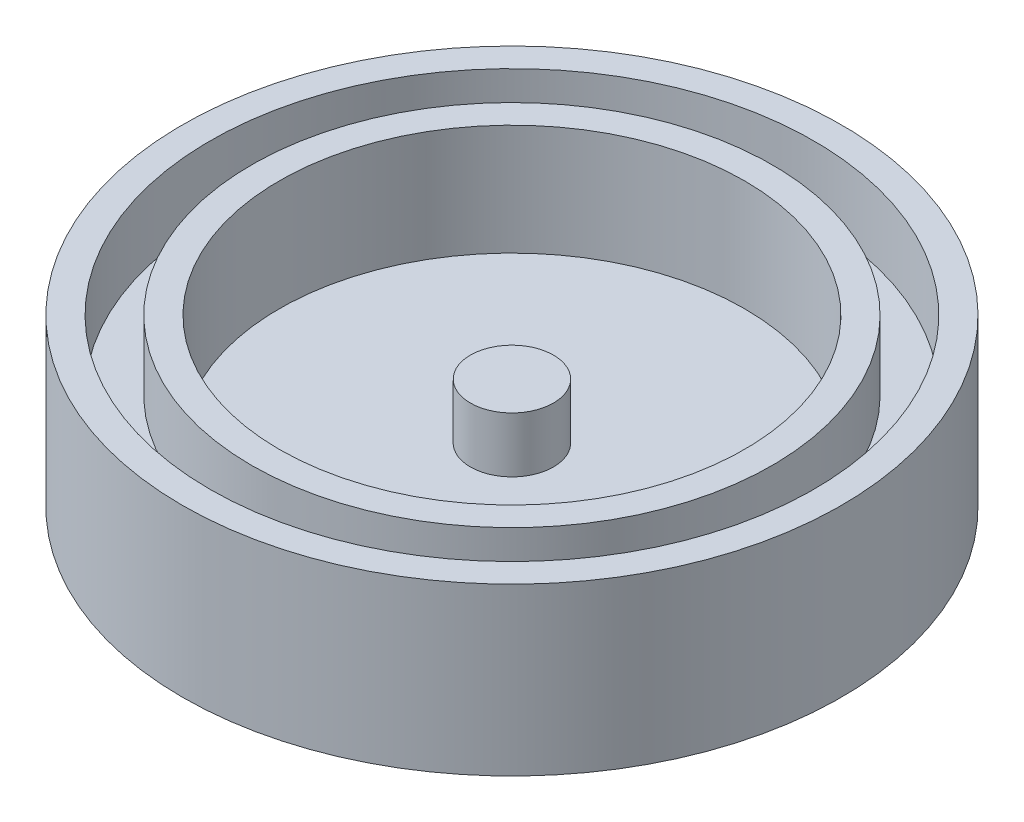
from build123d import *


with BuildPart() as part:
    # Sketch1 → Revolve1 (revolve)
    with BuildSketch(Plane.XY, mode=Mode.PRIVATE) as revolve1_sk:
        Polygon((0, 0), (-23.8, 0), (-23.8, 12), (-21.8, 12), (-21.8, 7), (-18.8, 7), (-18.8, 12), (-16.8, 12), (-16.8, 4), (-3, 4), (-3, 8), (0, 8), align=None)
    revolve(revolve1_sk.sketch.rotate(Axis((0, 8, 0), (0, -1, 0)), 270), axis=Axis((0, 8, 0), (0, -1, 0)))


solid = part.part
